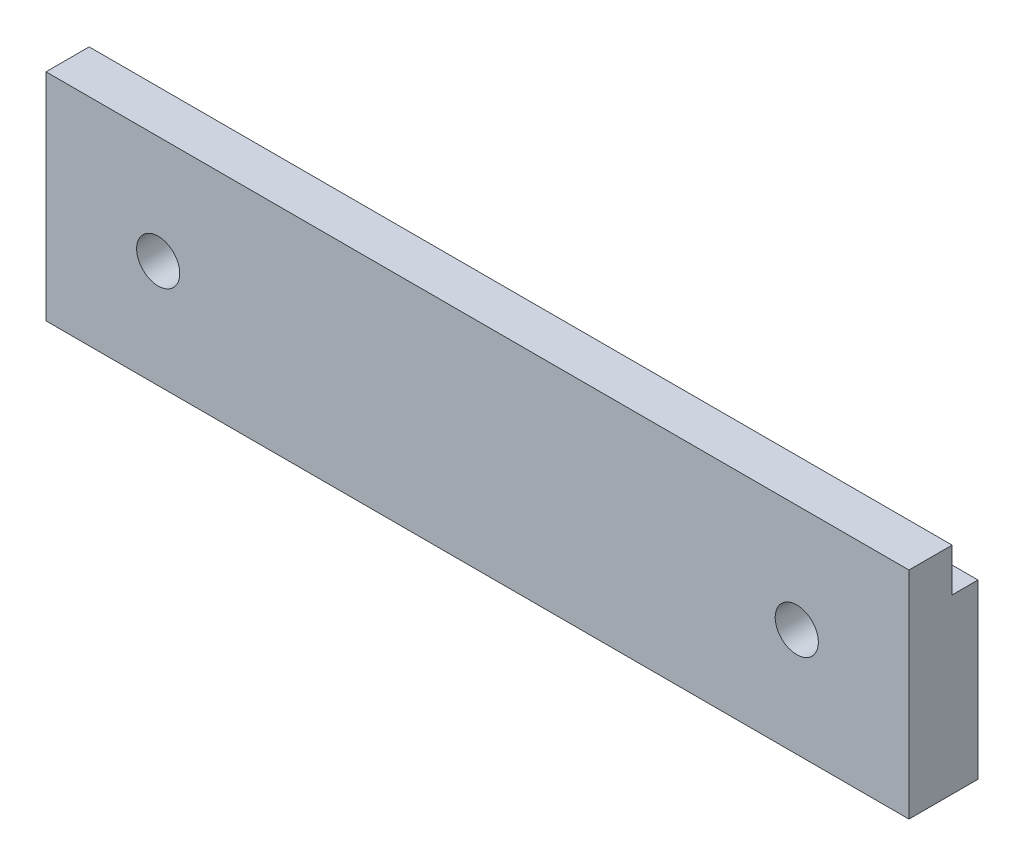
from build123d import *

# Parameters (mm, degrees)
BOSS_EXTRUDE1_DEPTH         = 100
TAP_DRILL_FOR_M6X1_0_TAP1_D = 5


with BuildPart() as part:
    # Sketch1 → Boss-Extrude1 (new body)
    with BuildSketch(Plane(origin=(0, 0, 0), x_dir=(0, 0, -1), z_dir=(1, 0, 0))):
        Polygon((0, 25), (0, 0), (8, 0), (8, 20), (5, 20), (5, 25), align=None)
    extrude(amount=BOSS_EXTRUDE1_DEPTH)

    # Tap Drill for M6x1.0 Tap1 (through all)
    with Locations(Plane(origin=(87, 12.5, 0), x_dir=(1, 0, 0), z_dir=(0, 0, 1))):
        with Locations((0, 0), (-74, 0)):
            Hole(TAP_DRILL_FOR_M6X1_0_TAP1_D / 2)


solid = part.part
